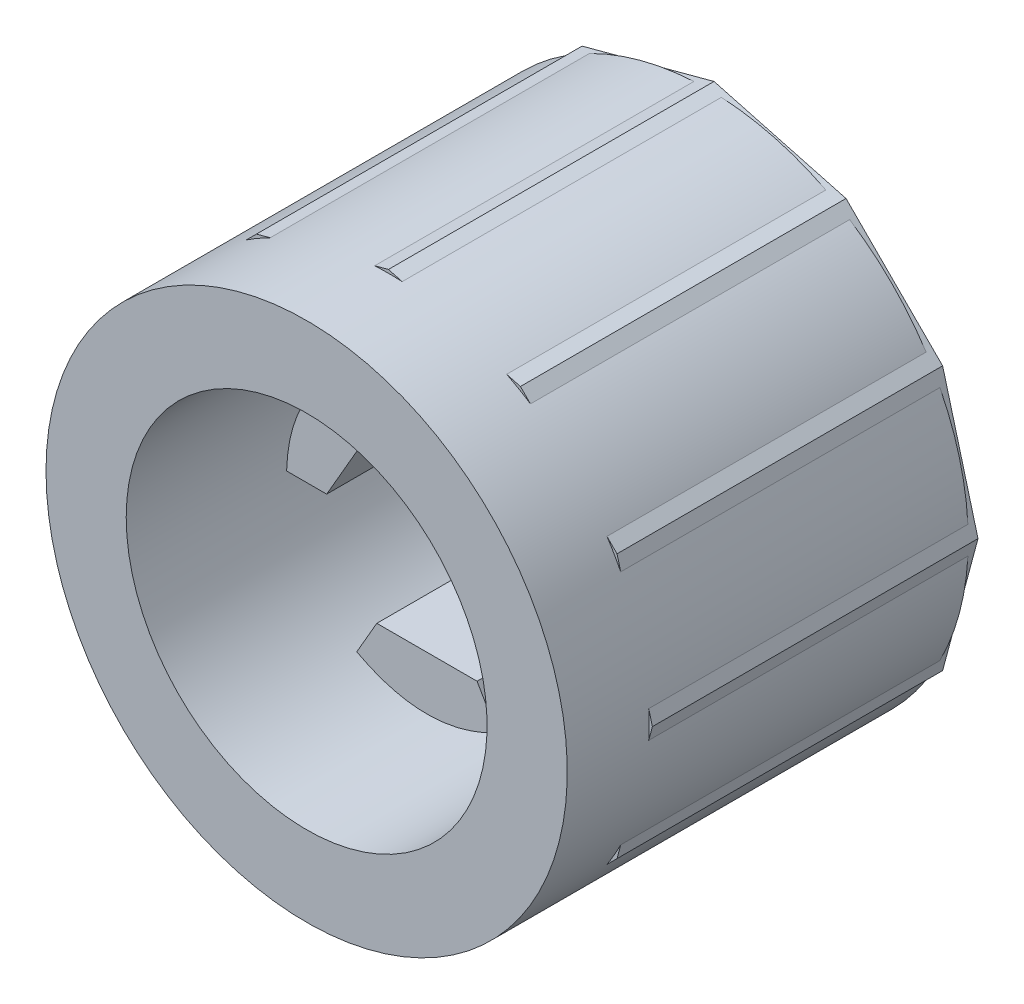
from build123d import *

# Parameters (mm, degrees)
EXTRUDE_THIN1_DEPTH = 4.7625
BOSS_EXTRUDE3_DEPTH = 4.7625
BOSS_EXTRUDE4_DEPTH = 4.7625
BOSS_EXTRUDE5_DEPTH = 4.7625
EXTRUDE_THIN2_DEPTH = 12.8905


with BuildPart() as part:
    # Sketch1 → Revolve1 (revolve)
    with BuildSketch(Plane(origin=(0, 0, 0), x_dir=(1, 0, 0), z_dir=(0, 1, 0)), mode=Mode.PRIVATE) as revolve1_sk:
        Polygon((3.889458747, 12.636440067), (-4.841791253, 12.636440067), (-4.841791253, 11.048940067), (-0.873041253, 11.048940067), (-0.873041253, 6.286440067), (0.714458747, 6.286440067), (0.714458747, 11.048940067), (2.301958747, 11.048940067), (2.301958747, -3.238559933), (5.476958747, -3.238559933), (5.476958747, 12.636440067), align=None)
    revolve(revolve1_sk.sketch.rotate(Axis((-4.841791253, 0, -12.636440067), (0, 0, 1)), 180), axis=Axis((-4.841791253, 0, -12.636440067), (0, 0, 1)))

    # Sketch3 → Extrude-Thin1 (add)
    with BuildSketch(Plane.XY.offset(-11.048940067)):
        Polygon((0.593428431, 0), (-2.124181411, 4.707038321), (-7.559401095, 4.707038321), (-10.277010937, 0), (-7.559401095, -4.707038321), (-2.124181411, -4.707038321), align=None)
        Polygon((-0.873041253, 0), (-2.857416253, 3.437038321), (-6.826166253, 3.437038321), (-8.810541253, 0), (-6.826166253, -3.437038321), (-2.857416253, -3.437038321), align=None, mode=Mode.SUBTRACT)
    extrude(amount=EXTRUDE_THIN1_DEPTH)

    # Sketch4 → Boss-Extrude3 (add)
    with BuildSketch(Plane.XY.offset(-6.286440067)):
        with BuildLine():
            Line((-8.810541253, 0), (-10.398041253, 0))
            add(Edge.make_bspline(
                [(-7.619916253, 4.81185365), (-10.301123719, 3.145408418), (-10.398041253, 0)],
                knots=[0, 0, 0, 1, 1, 1], degree=2))
            Line((-7.619916253, 4.81185365), (-6.826166253, 3.437038321))
            Line((-6.826166253, 3.437038321), (-8.810541253, 0))
        make_face()
    extrude(amount=BOSS_EXTRUDE3_DEPTH)

    # Sketch6 → Boss-Extrude4 (add)
    with BuildSketch(Plane.XY.offset(-6.286440067)):
        with BuildLine():
            Line((-2.857416253, 3.437038321), (-2.063666253, 4.81185365))
            add(Edge.make_bspline(
                [(-2.063666253, 4.81185365), (0.618739425, 3.143288031), (0.714458747, 0)],
                knots=[0, 0, 0, 1, 1, 1], degree=2))
            Line((0.714458747, 0), (-0.873041253, 0))
            Line((-0.873041253, 0), (-2.857416253, 3.437038321))
        make_face()
    extrude(amount=BOSS_EXTRUDE4_DEPTH)

    # Sketch7 → Boss-Extrude5 (add)
    with BuildSketch(Plane.XY.offset(-6.286440067)):
        with BuildLine():
            Line((-6.826166253, -3.437038321), (-7.619916253, -4.81185365))
            add(Edge.make_bspline(
                [(-7.619916253, -4.81185365), (-4.841791253, -6.30064635), (-2.063666253, -4.81185365)],
                knots=[0, 0, 0, 1, 1, 1], degree=2))
            Line((-2.063666253, -4.81185365), (-2.857416253, -3.437038321))
            Line((-2.857416253, -3.437038321), (-6.826166253, -3.437038321))
        make_face()
    extrude(amount=BOSS_EXTRUDE5_DEPTH)

    # Sketch11 → Extrude-Thin2 (add)
    with BuildSketch(Plane.XY):
        Polygon((-15.292021328, 0), (-13.891955973, -5.225115037), (-10.066906291, -9.05016472), (-4.841791253, -10.450230075), (0.383323784, -9.05016472), (4.208373467, -5.225115037), (5.608438822, 0), (4.208373467, 5.225115037), (0.383323784, 9.05016472), (-4.841791253, 10.450230075), (-10.066906291, 9.05016472), (-13.891955973, 5.225115037), align=None)
        Polygon((-15.029061178, 0), (-13.664225803, -5.093634963), (-9.935426216, -8.82243455), (-4.841791253, -10.187269925), (0.251843709, -8.82243455), (3.980643297, -5.093634963), (5.345478672, 0), (3.980643297, 5.093634963), (0.251843709, 8.82243455), (-4.841791253, 10.187269925), (-9.935426216, 8.82243455), (-13.664225803, 5.093634963), align=None, mode=Mode.SUBTRACT)
    extrude(amount=-EXTRUDE_THIN2_DEPTH)


solid = part.part
